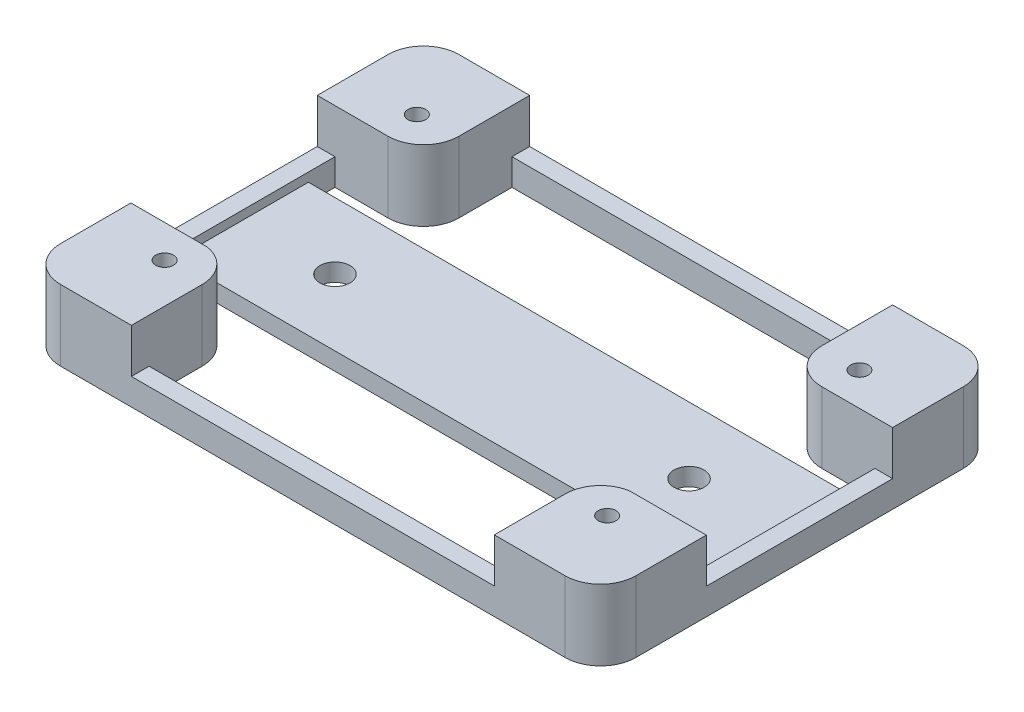
from build123d import *

# Parameters (mm, degrees)
SKETCH1_R           = 1
BOSS_EXTRUDE1_DEPTH = 8
SKETCH2_W           = 63
SKETCH2_H           = 15
BOSS_EXTRUDE2_DEPTH = 2
SKETCH3_R           = 1.7
CUT_EXTRUDE1_DEPTH  = 2
SKETCH4_W           = 41
SKETCH4_H           = 45
CUT_EXTRUDE2_DEPTH  = 5
SKETCH5_W           = 65
SKETCH5_H           = 21.051864014
CUT_EXTRUDE3_DEPTH  = 5


with BuildPart() as part:
    # Sketch1 → Boss-Extrude1 (new body)
    with BuildSketch(Plane(origin=(0, 0, 0), x_dir=(1, 0, 0), z_dir=(0, 1, 0))):
        with BuildLine():
            Line((-28.5, 22.5), (28.5, 22.5))
            ThreePointArc((28.5, 22.5), (31.328427125, 21.328427125), (32.5, 18.5))
            Line((32.5, 18.5), (32.5, -18.5))
            ThreePointArc((32.5, -18.5), (31.328427125, -21.328427125), (28.5, -22.5))
            Line((28.5, -22.5), (-28.5, -22.5))
            ThreePointArc((-28.5, -22.5), (-31.328427125, -21.328427125), (-32.5, -18.5))
            Line((-32.5, -18.5), (-32.5, 18.5))
            ThreePointArc((-32.5, 18.5), (-31.328427125, 21.328427125), (-28.5, 22.5))
        make_face()
        with Locations(Location((-25, 14.25, 0), (0, 0, 270))):
            Circle(SKETCH1_R, mode=Mode.SUBTRACT)
        with Locations(Location((25, 14.25, 0), (0, 0, 270))):
            Circle(SKETCH1_R, mode=Mode.SUBTRACT)
        with Locations(Location((25, -14.25, 0), (0, 0, 270))):
            Circle(SKETCH1_R, mode=Mode.SUBTRACT)
        with Locations(Location((-25, -14.25, 0), (0, 0, 270))):
            Circle(SKETCH1_R, mode=Mode.SUBTRACT)
        with BuildLine():
            Line((-30.5, 10.5), (-30.5, -10.5))
            Line((-30.5, -10.5), (-24.5, -10.5))
            ThreePointArc((-24.5, -10.5), (-21.671572875, -11.671572875), (-20.5, -14.5))
            Line((-20.5, -14.5), (-20.5, -20.5))
            Line((-20.5, -20.5), (20.5, -20.5))
            Line((20.5, -20.5), (20.5, -14.5))
            ThreePointArc((20.5, -14.5), (21.671572875, -11.671572875), (24.5, -10.5))
            Line((24.5, -10.5), (30.5, -10.5))
            Line((30.5, -10.5), (30.5, 10.5))
            Line((30.5, 10.5), (24.5, 10.5))
            ThreePointArc((24.5, 10.5), (21.671572875, 11.671572875), (20.5, 14.5))
            Line((20.5, 14.5), (20.5, 20.5))
            Line((20.5, 20.5), (-20.5, 20.5))
            Line((-20.5, 20.5), (-20.5, 14.5))
            ThreePointArc((-20.5, 14.5), (-21.671572875, 11.671572875), (-24.5, 10.5))
            Line((-24.5, 10.5), (-30.5, 10.5))
        make_face(mode=Mode.SUBTRACT)
    extrude(amount=BOSS_EXTRUDE1_DEPTH)

    # Sketch2 → Boss-Extrude2 (add)
    with BuildSketch(Plane(origin=(0, 0, 0), x_dir=(1, 0, 0), z_dir=(0, 1, 0))):
        Rectangle(SKETCH2_W, SKETCH2_H)
    extrude(amount=BOSS_EXTRUDE2_DEPTH)

    # Sketch3 → Cut-Extrude1 (cut)
    with BuildSketch(Plane(origin=(0, 2, 0), x_dir=(1, 0, 0), z_dir=(0, 1, 0))):
        with Locations(Location((-20, 0, 0), (0, 0, 270))):
            Circle(SKETCH3_R)
        with Locations(Location((20, 0, 0), (0, 0, 270))):
            Circle(SKETCH3_R)
    extrude(amount=-CUT_EXTRUDE1_DEPTH, mode=Mode.SUBTRACT)

    # Sketch4 → Cut-Extrude2 (cut)
    with BuildSketch(Plane(origin=(0, 8, 0), x_dir=(1, 0, 0), z_dir=(0, 1, 0))):
        Rectangle(SKETCH4_W, SKETCH4_H)
    extrude(amount=-CUT_EXTRUDE2_DEPTH, mode=Mode.SUBTRACT)

    # Sketch5 → Cut-Extrude3 (cut)
    with BuildSketch(Plane(origin=(0, 8, 0), x_dir=(1, 0, 0), z_dir=(0, 1, 0))):
        with Locations((0, -0.025932007)):
            Rectangle(SKETCH5_W, SKETCH5_H)
    extrude(amount=-CUT_EXTRUDE3_DEPTH, mode=Mode.SUBTRACT)


solid = part.part
